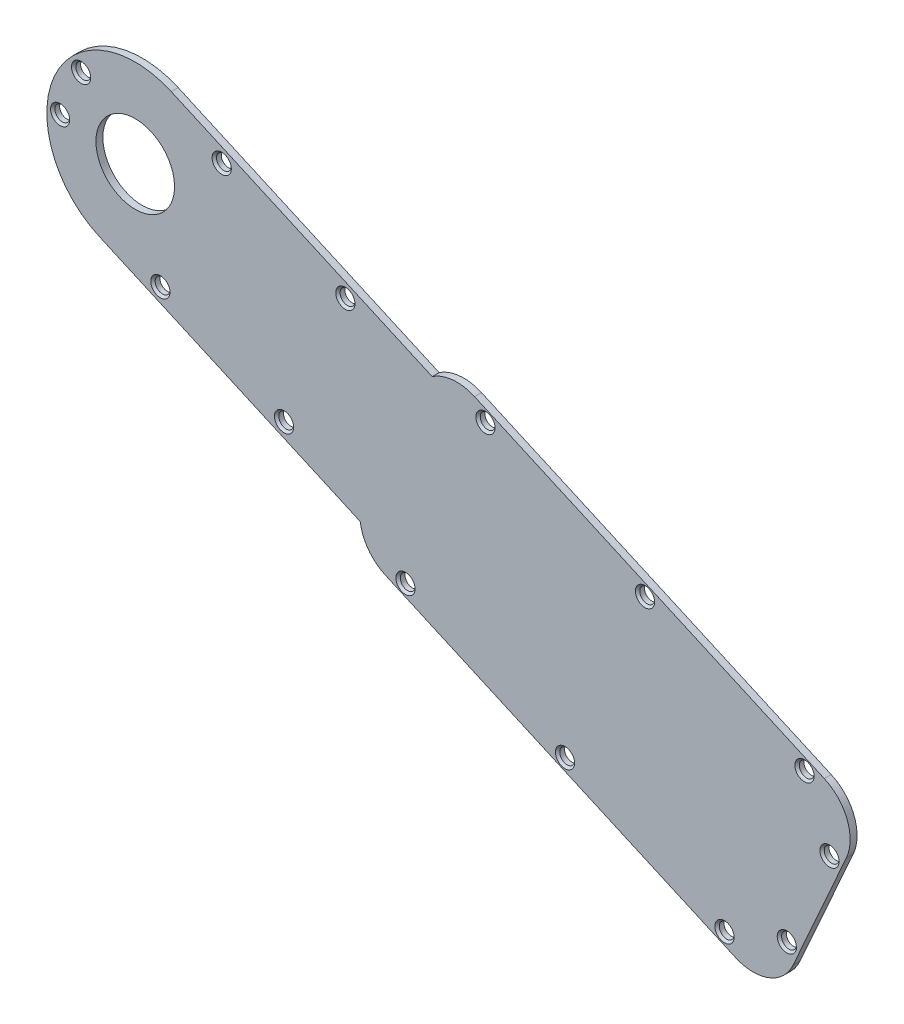
from build123d import *

# Parameters (mm, degrees)
BOSS_EXTRUDE1_DEPTH   = 1.5875
F_4_CLEARANCE_HOLE1_D = 3.4
HOLE1_D               = 18
CHAMFER1_SIZE         = 0.5
FILLET1_R             = 10


with BuildPart() as part:
    # Sketch1 → Boss-Extrude1 (new body)
    with BuildSketch(Plane.XY.offset(1.5875)):
        with BuildLine():
            Line((-122.373252992, 49.591627472), (-33.137949262, 9.81285715))
            Line((-33.137949262, 9.81285715), (-12.780339067, 55.480873389))
            Line((-12.780339067, 55.480873389), (-102.015642796, 95.25964371))
            ThreePointArc((-102.015642796, 95.25964371), (-106.983028684, 96.085831021), (-111.723245825, 94.386463641))
            Line((-111.723245825, 94.386463641), (-171.498000771, 121.032489918))
            ThreePointArc((-171.498000771, 121.032489918), (-198.238379477, 110.781775471), (-187.98766503, 84.041396765))
            Line((-187.98766503, 84.041396765), (-128.212910083, 57.395370488))
            ThreePointArc((-128.212910083, 57.395370488), (-126.308202352, 52.73386896), (-122.373252992, 49.591627472))
        make_face()
    extrude(amount=-BOSS_EXTRUDE1_DEPTH)

    # #4 Clearance Hole1 (through all)
    with Locations(Plane.XY.offset(1.5875)):
        with Locations((-99.517086056, 91.408706914), (-62.982673065, 75.122618757), (-26.448260075, 58.836530601), (-20.722062659, 44.787930558), (-30.493715553, 22.867282764), (-44.77010925, 17.735315986), (-81.304522241, 34.021404143), (-117.838935231, 50.307492299), (-131.618242769, 99.970559768), (-145.664993804, 68.459628564), (-173.979163871, 81.081346885), (-159.932412836, 112.592278089), (-192.145991763, 114.525444092), (-196.950263565, 103.748070885)):
            Hole(F_4_CLEARANCE_HOLE1_D / 2)

    # Hole1 (through all)
    with Locations(Plane(origin=(0, 0, 0), x_dir=(-1, 0, 0), z_dir=(0, 0, -1))):
        with Locations((179.7428329, 102.536943342)):
            Hole(HOLE1_D / 2)

    # Chamfer1
    chamfer1_edges = [part.edges().sort_by_distance(p)[0] for p in [
        (-24.748260075, 58.836530601, 1.5875),
        (-61.282673065, 75.122618757, 1.5875),
        (-97.817086056, 91.408706914, 1.5875),
        (-195.250263565, 103.748070885, 1.5875),
        (-190.445991763, 114.525444092, 1.5875),
        (-158.232412836, 112.592278089, 1.5875),
        (-172.279163871, 81.081346885, 1.5875),
        (-143.964993804, 68.459628564, 1.5875),
        (-129.918242769, 99.970559768, 1.5875),
        (-116.138935231, 50.307492299, 1.5875),
        (-79.604522241, 34.021404143, 1.5875),
        (-43.07010925, 17.735315986, 1.5875),
        (-28.793715553, 22.867282764, 1.5875),
        (-19.022062659, 44.787930558, 1.5875),
    ]]
    chamfer(chamfer1_edges, length=CHAMFER1_SIZE)

    # Fillet1
    fillet1_edges = [part.edges().sort_by_distance(p)[0] for p in [
        (-12.780339067, 55.480873389, 0.79375),
        (-33.137949262, 9.81285715, 0.79375),
    ]]
    fillet(fillet1_edges, radius=FILLET1_R)


solid = part.part
